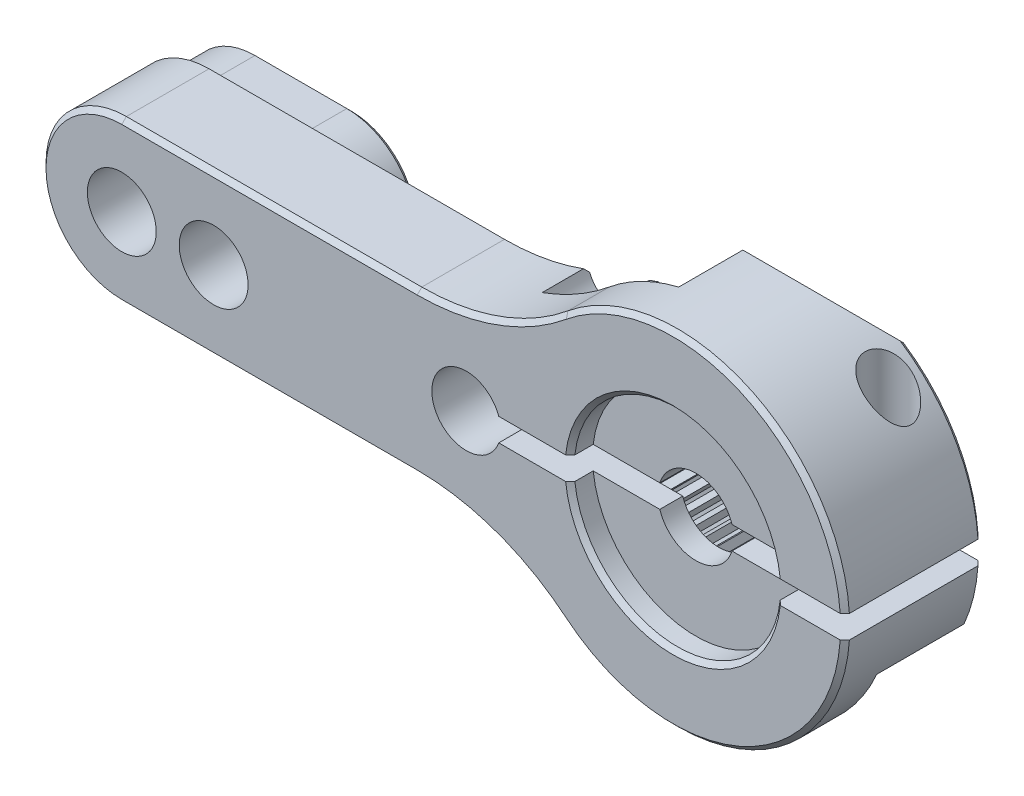
from build123d import *

# Parameters (mm, degrees)
ESQUISSE1_R                  = 1.65
ESQUISSE1_R_2                = 1.5
BOSS_EXTRU_1_DEPTH           = 6
ESQUISSE2_W                  = 18.914213562
ESQUISSE2_H                  = 1
ENL_V_MAT_EXTRU_1_DEPTH      = 6
ENL_V_MAT_EXTRU_2_DEPTH      = 2
ENL_V_MAT_EXTRU_3_DEPTH      = 4
ESQUISSE5_R                  = 1
ENL_V_MAT_EXTRU_4_DEPTH      = 31.041637772
ESQUISSE6_R                  = 1
ENL_V_MAT_EXTRU_5_DEPTH      = 31.041637792
ENL_V_MAT_EXTRU_6_DEPTH      = 10
ENL_V_MAT_EXTRU_6_DEPTH_BACK = 10
ESQUISSE8_R                  = 3
ENL_V_MAT_EXTRU_7_DEPTH      = 4
BOSS_EXTRU_2_DEPTH           = 4
R_P_TITION_CIRCULAIRE1_COUNT = 36
ESQUISSE10_W                 = 11.375009128
ESQUISSE10_H                 = 1
ENL_V_MAT_EXTRU_8_DEPTH      = 30.129023374
CHANFREIN1_SIZE              = 0.2
ESQUISSE11_R                 = 4.5
ENL_V_MAT_EXTRU_9_DEPTH      = 1
CHANFREIN2_SIZE              = 0.2


with BuildPart() as part:
    # Esquisse1 → Boss.-Extru.1 (new body)
    with BuildSketch(Plane.XY):
        with BuildLine():
            Line((-11.135528726, 3.5), (-24, 3.5))
            ThreePointArc((-24, 3.5), (-27.5, 0), (-24, -3.5))
            Line((-24, -3.5), (-11.135528726, -3.5))
            ThreePointArc((-11.135528726, -3.5), (-7.754911707, -4.088760519), (-4.772369454, -5.785714286))
            ThreePointArc((-4.772369454, -5.785714286), (7.5, 0), (-4.772369454, 5.785714286))
            ThreePointArc((-4.772369454, 5.785714286), (-7.754911707, 4.088760519), (-11.135528726, 3.5))
        make_face()
        Circle(ESQUISSE1_R, mode=Mode.SUBTRACT)
        with Locations((-9, 0)):
            Circle(ESQUISSE1_R_2, mode=Mode.SUBTRACT)
        with Locations((-24, 0)):
            Circle(ESQUISSE1_R_2, mode=Mode.SUBTRACT)
        with Locations((-20, 0)):
            Circle(ESQUISSE1_R_2, mode=Mode.SUBTRACT)
    extrude(amount=BOSS_EXTRU_1_DEPTH)

    # Esquisse2 → Enlèv. mat.-Extru.1 (cut)
    with BuildSketch(Plane.XY.offset(6)):
        with Locations((-0.957106781, 0)):
            Rectangle(ESQUISSE2_W, ESQUISSE2_H)
    extrude(amount=-ENL_V_MAT_EXTRU_1_DEPTH, mode=Mode.SUBTRACT)

    # Esquisse3 → Enlèv. mat.-Extru.2 (cut)
    with BuildSketch(Plane(origin=(0, 0, 0), x_dir=(-1, 0, 0), z_dir=(0, 0, -1))):
        with BuildLine():
            Line((24, -3.5), (11.135528726, -3.5))
            ThreePointArc((11.135528726, -3.5), (7.754911707, -4.088760519), (4.772369454, -5.785714286))
            ThreePointArc((4.772369454, -5.785714286), (7.5, 0), (4.772369454, 5.785714286))
            ThreePointArc((4.772369454, 5.785714286), (7.754911707, 4.088760519), (11.135528726, 3.5))
            Line((11.135528726, 3.5), (24, 3.5))
            ThreePointArc((24, 3.5), (27.5, 0), (24, -3.5))
        make_face()
        with BuildLine():
            Line((24, -3), (20, -3))
            ThreePointArc((20, -3), (17, 0), (20, 3))
            Line((20, 3), (24, 3))
            ThreePointArc((24, 3), (27, 0), (24, -3))
        make_face(mode=Mode.SUBTRACT)
    extrude(amount=-ENL_V_MAT_EXTRU_2_DEPTH, mode=Mode.SUBTRACT)

    # Esquisse4 → Enlèv. mat.-Extru.3 (cut)
    with BuildSketch(Plane(origin=(0, 0, 0), x_dir=(-1, 0, 0), z_dir=(0, 0, -1))):
        with BuildLine():
            Line((-7.5, -3), (-3.25, -3))
            ThreePointArc((-3.25, -3), (-2.189339828, -3.439339828), (-1.75, -4.5))
            Line((-1.75, -4.5), (-1.75, -7.5))
            Line((-1.75, -7.5), (-7.5, -7.5))
            Line((-7.5, -7.5), (-7.5, -3))
        make_face()
        with BuildLine():
            Line((1.75, 7.5), (7.75, 7.5))
            Line((7.75, 7.5), (7.75, 4.5))
            ThreePointArc((7.75, 4.5), (7.310660172, 3.439339828), (6.25, 3))
            Line((6.25, 3), (3.25, 3))
            ThreePointArc((3.25, 3), (2.189339828, 3.439339828), (1.75, 4.5))
            Line((1.75, 4.5), (1.75, 7.5))
        make_face()
    extrude(amount=-ENL_V_MAT_EXTRU_3_DEPTH, mode=Mode.SUBTRACT)

    # Esquisse5 → Enlèv. mat.-Extru.4 (cut, through all)
    with BuildSketch(Plane.XZ.offset(3)):
        with Locations((4.873863542, 1.5)):
            Circle(ESQUISSE5_R)
    extrude(amount=-ENL_V_MAT_EXTRU_4_DEPTH, mode=Mode.SUBTRACT)

    # Esquisse6 → Enlèv. mat.-Extru.5 (cut, through all)
    with BuildSketch(Plane(origin=(0, 3, 0), x_dir=(1, 0, 0), z_dir=(0, 1, 0))):
        with Locations(Location((-5.233314774, -1.5, 0), (0, 0, 270))):
            Circle(ESQUISSE6_R)
    extrude(amount=-ENL_V_MAT_EXTRU_5_DEPTH, mode=Mode.SUBTRACT)

    # Esquisse7 → Enlèv. mat.-Extru.6 (cut, two sides: drawn at the far end of the back side and taken through both)
    with BuildSketch(Plane(origin=(0, 0, 0), x_dir=(0, 0, -1), z_dir=(1, 0, 0)).offset(-ENL_V_MAT_EXTRU_6_DEPTH_BACK)):
        Polygon((-1.414213562, 7.5), (0, 6.085786438), (0, 7.5), align=None)
        Polygon((0, -6.085786438), (-1.414213562, -7.5), (0, -7.5), align=None)
    extrude(amount=ENL_V_MAT_EXTRU_6_DEPTH + ENL_V_MAT_EXTRU_6_DEPTH_BACK, mode=Mode.SUBTRACT)

    # Esquisse8 → Enlèv. mat.-Extru.7 (cut)
    with BuildSketch(Plane(origin=(0, 0, 0), x_dir=(-1, 0, 0), z_dir=(0, 0, -1))):
        Circle(ESQUISSE8_R)
    extrude(amount=-ENL_V_MAT_EXTRU_7_DEPTH, mode=Mode.SUBTRACT)

    # Esquisse9 → Boss.-Extru.2 (add)
    with BuildSketch(Plane(origin=(0, 0, 0), x_dir=(-1, 0, 0), z_dir=(0, 0, -1))):
        Polygon((-0.202072594, 3), (0, 2.65), (0.202072594, 3), align=None)
    boss_extru_2 = extrude(amount=-BOSS_EXTRU_2_DEPTH)

    # Répétition circulaire1: Boss.-Extru.2 ×36 about axis, 2 skipped
    r_p_tition_circulaire1_axis = Axis((0, 0, 0), (0, 0, -1))
    add([boss_extru_2.rotate(r_p_tition_circulaire1_axis, i * 360 / R_P_TITION_CIRCULAIRE1_COUNT) for i in range(1, R_P_TITION_CIRCULAIRE1_COUNT) if i not in (9, 27)])

    # Esquisse10 → Enlèv. mat.-Extru.8 (cut, through all)
    with BuildSketch(Plane(origin=(0, 0, 0), x_dir=(-1, 0, 0), z_dir=(0, 0, -1))):
        with Locations((-1.79581021, 0)):
            Rectangle(ESQUISSE10_W, ESQUISSE10_H)
    extrude(amount=-ENL_V_MAT_EXTRU_8_DEPTH, mode=Mode.SUBTRACT)

    # Chanfrein1
    chanfrein1_edges = [part.edges().sort_by_distance(p)[0] for p in [
        (-17.567764363, -3.5, 2),
        (-27, 0, 0),
        (-17, 0, 0),
        (-22, 3, 0),
        (-7.271599305, 1.836802534, 0),
        (-7.754911707, -4.088760519, 6),
        (7.28660705, -1.776332655, 0),
        (2.970185181, -6.886798965, 6),
        (-8.527137949, -3.84617705, 2),
        (-7.754911707, 4.088760519, 6),
        (-17.567764363, 3.5, 6),
        (6.557767222, 3.639462744, 0),
        (2.970185181, 6.886798965, 6),
        (-27.5, 0, 6),
        (-6.557767222, -3.639462744, 0),
        (-17.567764363, -3.5, 6),
        (-9.39008473, 3.653506956, 2),
        (-17.567764363, 3.5, 2),
        (-27.5, 0, 2),
    ]]
    chamfer(chanfrein1_edges, length=CHANFREIN1_SIZE)

    # Esquisse11 → Enlèv. mat.-Extru.9 (cut)
    with BuildSketch(Plane.XY.offset(6)):
        Circle(ESQUISSE11_R)
    extrude(amount=-ENL_V_MAT_EXTRU_9_DEPTH, mode=Mode.SUBTRACT)

    # Chanfrein2
    chanfrein2_edges = [part.edges().sort_by_distance(p)[0] for p in [
        (0, 4.5, 6),
        (0, -4.5, 6),
    ]]
    chamfer(chanfrein2_edges, length=CHANFREIN2_SIZE)


solid = part.part
